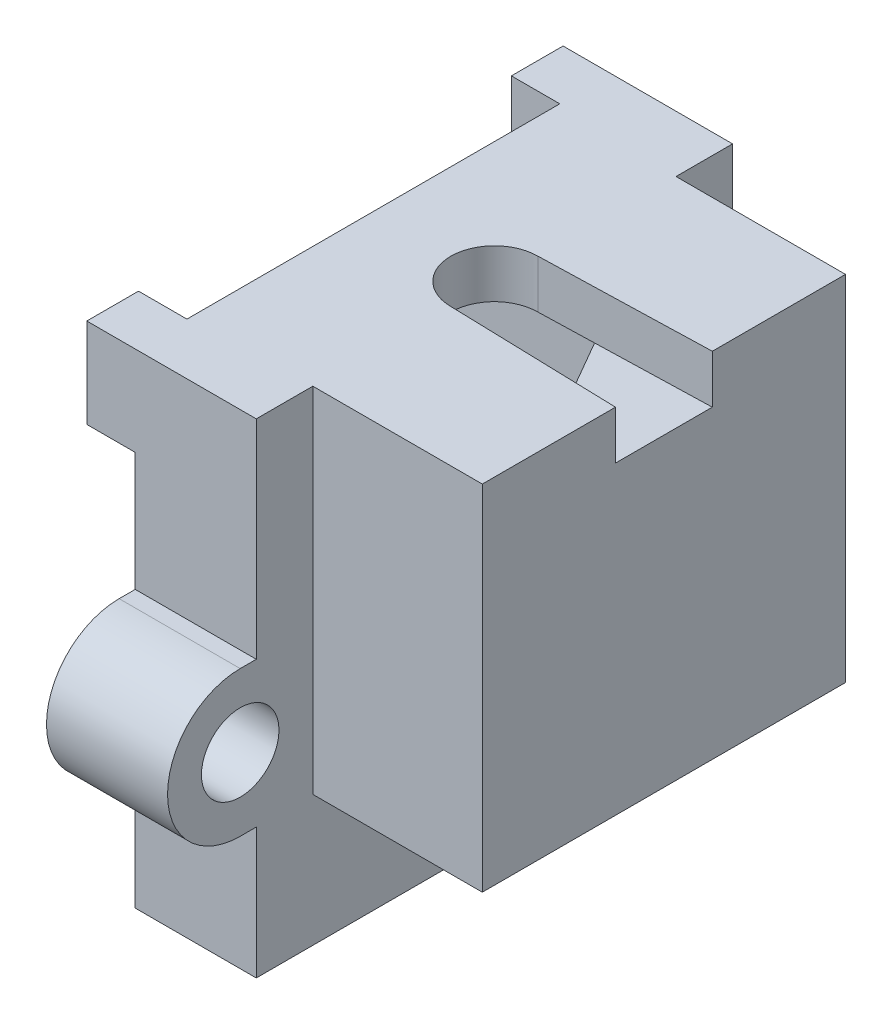
from build123d import *

# Parameters (mm, degrees)
SKETCH1_W           = 12
SKETCH1_H           = 15
BOSS_EXTRUDE1_DEPTH = 20
SKETCH2_R           = 1.6
BOSS_EXTRUDE2_DEPTH = 5
SKETCH3_R           = 1.6
CUT_EXTRUDE1_DEPTH  = 10
CUT_EXTRUDE2_DEPTH  = 3
CUT_EXTRUDE3_DEPTH  = 2
BOSS_EXTRUDE4_DEPTH = 3.7
BOSS_EXTRUDE5_START = -5
SKETCH8_W           = 2.336067977
SKETCH8_H           = 8.6
BOSS_EXTRUDE5_DEPTH = 5
SKETCH10_W          = 15
SKETCH10_H          = 5.4
CUT_EXTRUDE5_DEPTH  = 7
BOSS_EXTRUDE8_START = -5
SKETCH13_W          = 2.336067977
SKETCH13_H          = 5.4
BOSS_EXTRUDE8_DEPTH = 5


with BuildPart() as part:
    # Sketch1 → Boss-Extrude1 (new body)
    with BuildSketch(Plane(origin=(0, 0, 0), x_dir=(1, 0, 0), z_dir=(0, 1, 0))):
        Rectangle(SKETCH1_W, SKETCH1_H)
    extrude(amount=BOSS_EXTRUDE1_DEPTH)

    # Sketch2 → Boss-Extrude2 (add)
    # profile 1 of 2: a face of its own
    with BuildSketch(Plane.ZY.offset(6)):
        with BuildLine():
            Line((10.5, 11.4), (7.5, 11.4))
            Line((7.5, 11.4), (7.5, 5.4))
            Line((7.5, 5.4), (10.5, 5.4))
            ThreePointArc((10.5, 5.4), (13.5, 8.4), (10.5, 11.4))
        make_face()
        with Locations((10.5, 8.4)):
            Circle(SKETCH2_R, mode=Mode.SUBTRACT)
    # profile 2 of 2: a face of its own
    with BuildSketch(Plane.ZY.offset(6)):
        with BuildLine():
            Line((-10.5, 11.4), (-7.5, 11.4))
            Line((-7.5, 11.4), (-7.5, 5.4))
            Line((-7.5, 5.4), (-10.5, 5.4))
            ThreePointArc((-10.5, 5.4), (-13.5, 8.4), (-10.5, 11.4))
        make_face()
        with Locations((-10.5, 8.4)):
            Circle(SKETCH2_R, mode=Mode.SUBTRACT)
    extrude(amount=-BOSS_EXTRUDE2_DEPTH)

    # Sketch3 → Cut-Extrude1 (cut)
    with BuildSketch(Plane(origin=(0, 20, 0), x_dir=(1, 0, 0), z_dir=(0, 1, 0))):
        with Locations(Location((-1, 0, 0), (0, 0, 270))):
            Circle(SKETCH3_R)
    extrude(amount=-CUT_EXTRUDE1_DEPTH, mode=Mode.SUBTRACT)

    # Sketch4 → Cut-Extrude2 (cut)
    with BuildSketch(Plane(origin=(0, 18, 0), x_dir=(1, 0, 0), z_dir=(0, 1, 0))):
        Polygon((-2.674315781, 2.9), (-6, 2.9), (-6, -2.9), (-2.674315781, -2.9), (0.674315781, -2.9), (2.348631561, 0), (0.674315781, 2.9), align=None)
    extrude(amount=-CUT_EXTRUDE2_DEPTH, mode=Mode.SUBTRACT)

    # Sketch5 → Cut-Extrude3 (cut)
    with BuildSketch(Plane(origin=(0, 18, 0), x_dir=(1, 0, 0), z_dir=(0, 1, 0))):
        with BuildLine():
            Line((-1, 1.8), (6, 2))
            Line((6, 2), (6, 0))
            Line((6, 0), (6, -2))
            Line((6, -2), (-1, -1.8))
            ThreePointArc((-1, -1.8), (-2.8, 0), (-1, 1.8))
        make_face()
    extrude(amount=CUT_EXTRUDE3_DEPTH, mode=Mode.SUBTRACT)

    # Sketch6 → Boss-Extrude4 (add)
    with BuildSketch(Plane(origin=(0, 20, 0), x_dir=(1, 0, 0), z_dir=(0, 1, 0))):
        Polygon((-6, 7.7), (-6, 7.5), (-1, 7.5), (-1, 9.836067977), (-8, 9.836067977), (-8, 7.7), align=None)
        Polygon((-1, -7.5), (-6, -7.5), (-6, -7.7), (-8, -7.7), (-8, -9.836067977), (-1, -9.836067977), align=None)
    extrude(amount=-BOSS_EXTRUDE4_DEPTH)

    # Sketch8 → Boss-Extrude5 (add)
    with BuildSketch(Plane(origin=(-1, 0, 0), x_dir=(0, 0, -1), z_dir=(1, 0, 0)).offset(BOSS_EXTRUDE5_START)):
        with Locations((-8.668033989, 15.7)):
            Rectangle(SKETCH8_W, SKETCH8_H)
        with Locations((8.668033989, 15.7)):
            Rectangle(SKETCH8_W, SKETCH8_H)
    extrude(amount=BOSS_EXTRUDE5_DEPTH)

    # Sketch10 → Cut-Extrude5 (cut)
    with BuildSketch(Plane(origin=(6, 0, 0), x_dir=(0, 0, -1), z_dir=(1, 0, 0))):
        with Locations((0, 2.7)):
            Rectangle(SKETCH10_W, SKETCH10_H)
    extrude(amount=-CUT_EXTRUDE5_DEPTH, mode=Mode.SUBTRACT)

    # Sketch13 → Boss-Extrude8 (add)
    with BuildSketch(Plane(origin=(-1, 0, 0), x_dir=(0, 0, -1), z_dir=(1, 0, 0)).offset(BOSS_EXTRUDE8_START)):
        with Locations((8.668033989, 2.7)):
            Rectangle(SKETCH13_W, SKETCH13_H)
        with Locations((-8.668033989, 2.7)):
            Rectangle(SKETCH13_W, SKETCH13_H)
    extrude(amount=BOSS_EXTRUDE8_DEPTH)


solid = part.part
